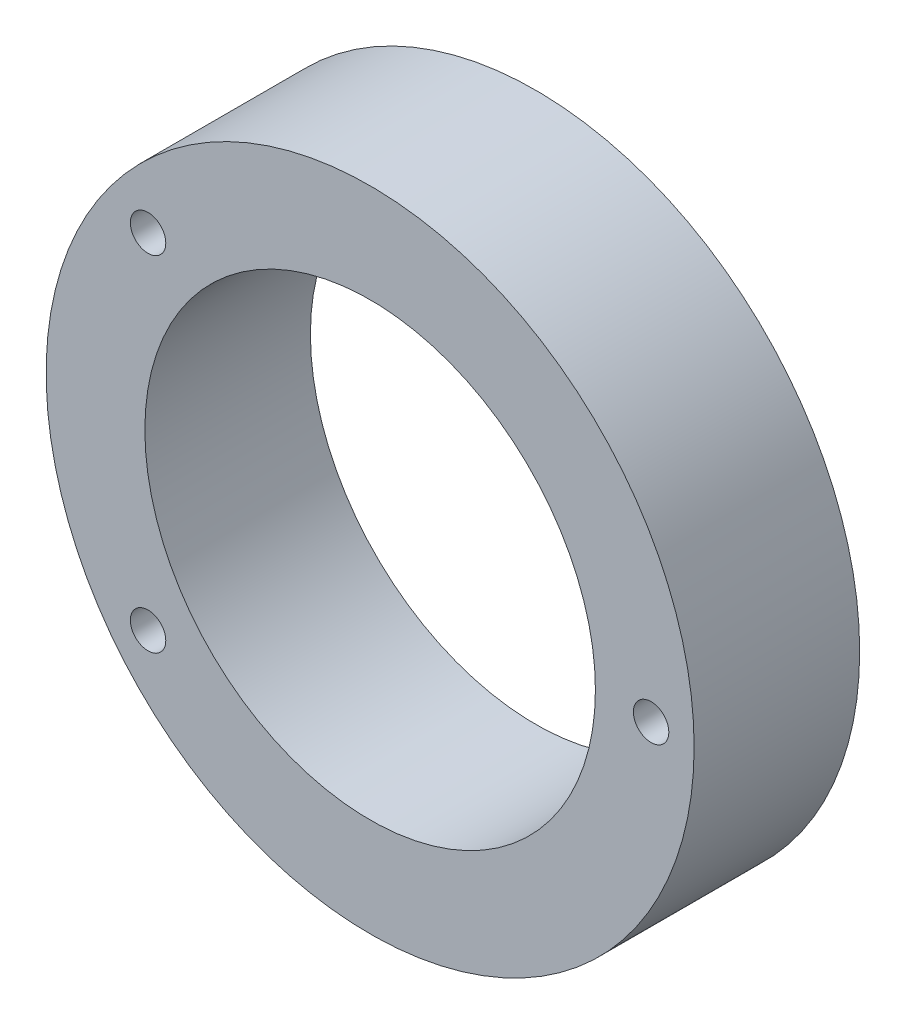
from build123d import *

# Parameters (mm, degrees)
SKETCH1_R           = 32
SKETCH1_R_2         = 22.25
SKETCH1_R_3         = 1.75
BOSS_EXTRUDE1_DEPTH = 16.35


with BuildPart() as part:
    # Sketch1 → Boss-Extrude1 (new body)
    with BuildSketch(Plane.XY):
        Circle(SKETCH1_R)
        Circle(SKETCH1_R_2, mode=Mode.SUBTRACT)
        with Locations((-21.932737229, 17.000515805)):
            Circle(SKETCH1_R_3, mode=Mode.SUBTRACT)
        with Locations((-21.932737229, -17.000515805)):
            Circle(SKETCH1_R_3, mode=Mode.SUBTRACT)
        with Locations((27.75, 0)):
            Circle(SKETCH1_R_3, mode=Mode.SUBTRACT)
    extrude(amount=BOSS_EXTRUDE1_DEPTH)


solid = part.part
